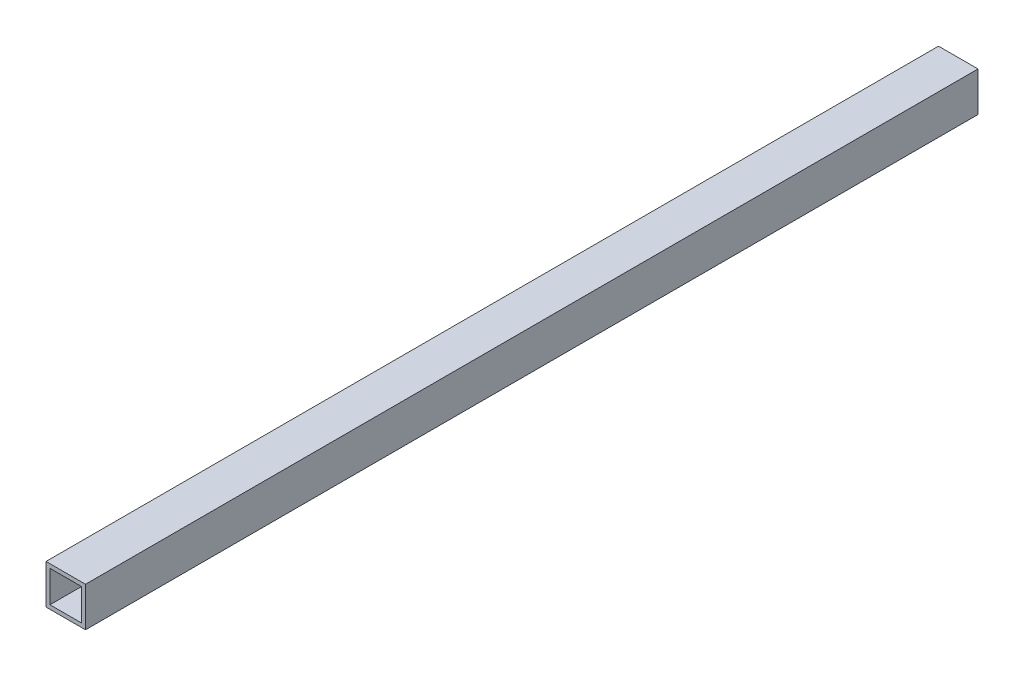
from build123d import *

# Parameters (mm, degrees)
CROQUIS1_W              = 20
CROQUIS1_H              = 20
CROQUIS1_W_2            = 16
CROQUIS1_H_2            = 16
SALIENTE_EXTRUIR1_DEPTH = 226


with BuildPart() as part:
    # Croquis1 → Saliente-Extruir1 (new, symmetric)
    with BuildSketch(Plane.XY):
        Rectangle(CROQUIS1_W, CROQUIS1_H)
        Rectangle(CROQUIS1_W_2, CROQUIS1_H_2, mode=Mode.SUBTRACT)
    extrude(amount=SALIENTE_EXTRUIR1_DEPTH, both=True)


solid = part.part
